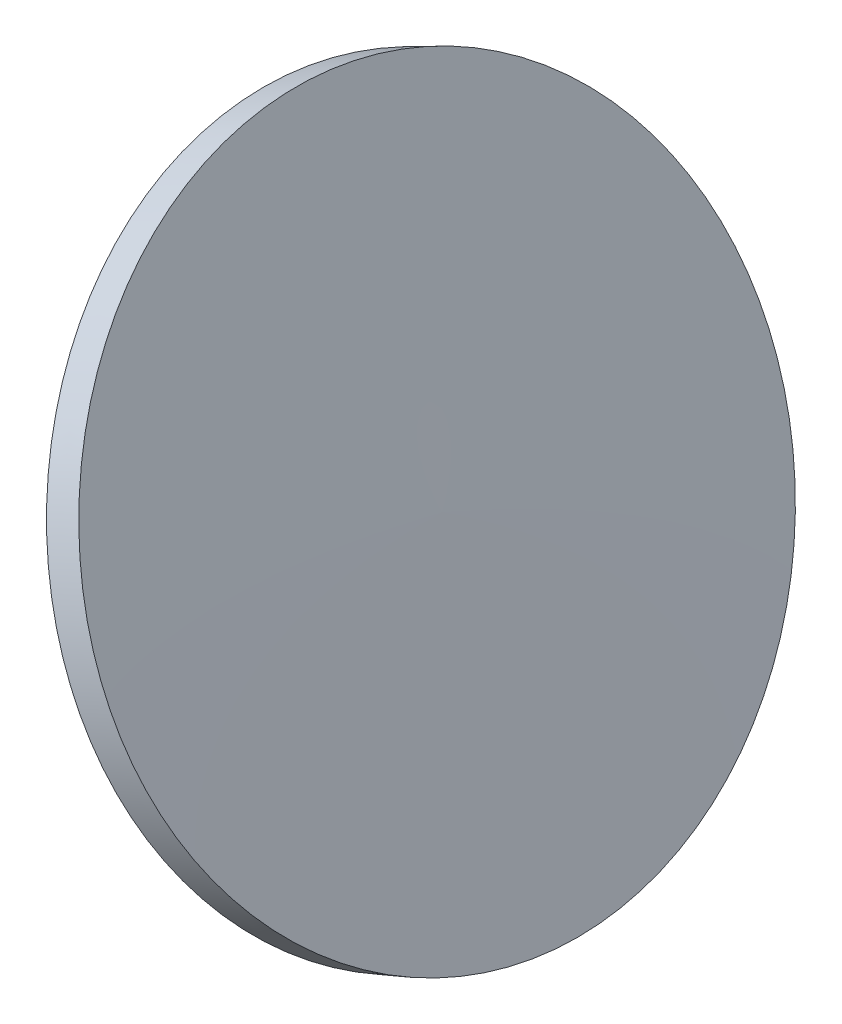
from build123d import *


with BuildPart() as part:
    # 草图2 → 旋转2 (revolve)
    with BuildSketch(Plane.XY, mode=Mode.PRIVATE) as revolve_2_sk:
        with BuildLine():
            Line((128.574547303, 217.762044871), (129.05447771, 217.98806914))
            ThreePointArc((129.05447771, 217.98806914), (128.003038298, 220.113549802), (126.964014188, 222.245127101))
            Line((126.964014188, 222.245127101), (126.487444236, 221.99998812))
            ThreePointArc((126.487444236, 221.99998812), (127.549508829, 219.89013381), (128.574547303, 217.762044871))
        make_face()
    revolve(revolve_2_sk.sketch.rotate(Axis((128.574547303, 217.762044871, 0), (0.9046918110299944, 0.426066575848504, 0)), 180), axis=Axis((128.574547303, 217.762044871, 0), (0.9046918110299944, 0.426066575848504, 0)))


solid = part.part
